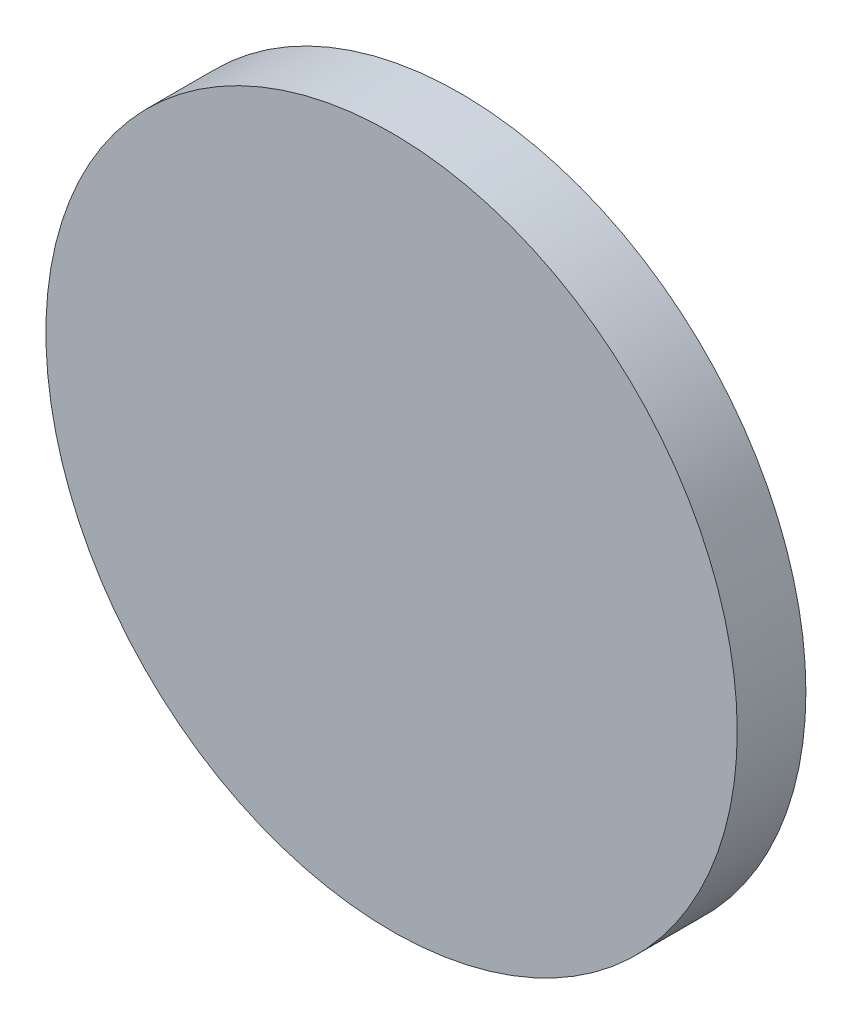
from build123d import *


with BuildPart() as part:
    # 草图1 → 旋转1 (revolve)
    with BuildSketch(Plane(origin=(0, 0, 0), x_dir=(1, 0, 0), z_dir=(0, 1, 0))):
        with BuildLine():
            Line((0, 0), (10, 0))
            Line((10, 0), (10, 1.9865734))
            ThreePointArc((10, 1.9865734), (5.100340348, 3.491642827), (0, 4))
            Line((0, 4), (0, 1.9865734))
            Line((0, 1.9865734), (0, 0))
        make_face()
    revolve(axis=Axis((0, 0, -1.9865734), (0, 0, -1)))


solid = part.part
